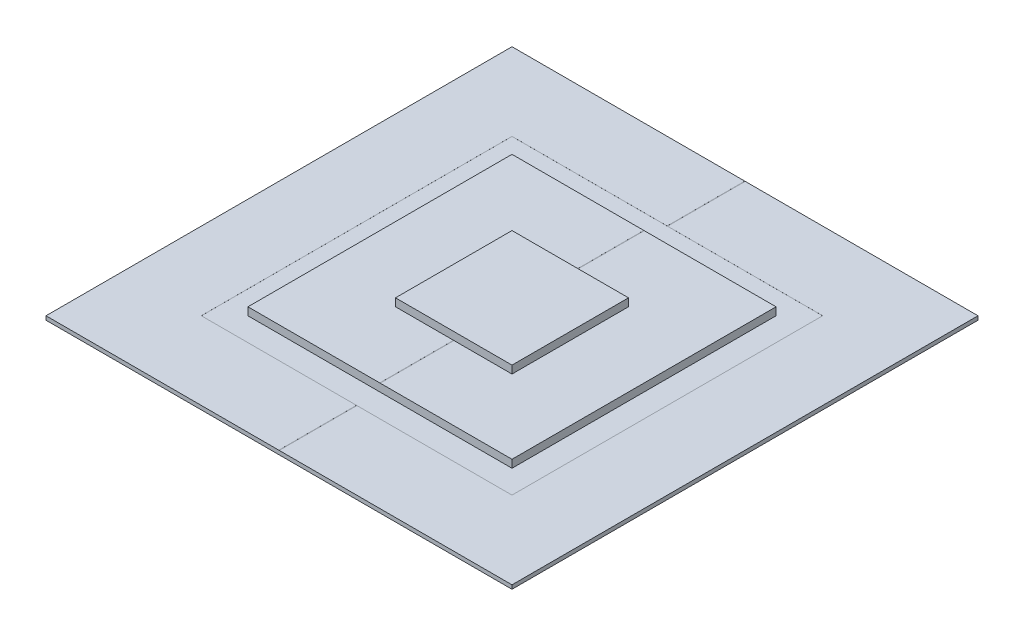
from build123d import *

# Parameters (mm, degrees)
SKETCH1_W             = 12000
SKETCH1_H             = 12000
SKETCH1_W_2           = 8000
SKETCH1_H_2           = 8000
BOSS_EXTRUDE1_DEPTH   = 100
SKETCH1_W_3           = 6800
SKETCH1_H_3           = 6800
BOSS_EXTRUDE1_2_DEPTH = 100
SKETCH2_W             = 8000
SKETCH2_H             = 8000
SKETCH2_W_2           = 6800
SKETCH2_H_2           = 6800
BOSS_EXTRUDE3_DEPTH   = 99
SKETCH3_W             = 10
SKETCH3_H             = 12000
CUT_EXTRUDE1_DEPTH    = 0.5
SKETCH4_W             = 3395
SKETCH4_H             = 6800
BOSS_EXTRUDE4_DEPTH   = 200
SKETCH5_W             = 10
SKETCH5_H             = 6800
BOSS_EXTRUDE5_DEPTH   = 200
SKETCH6_W             = 3000
SKETCH6_H             = 3000
BOSS_EXTRUDE6_DEPTH   = 200


with BuildPart() as part:
    # Sketch1 → Boss-Extrude1 (new body)
    with BuildSketch(Plane(origin=(0, 0, 0), x_dir=(1, 0, 0), z_dir=(0, 1, 0))):
        with Locations((6000, -6000)):
            Rectangle(SKETCH1_W, SKETCH1_H)
        with Locations((6000, -6000)):
            Rectangle(SKETCH1_W_2, SKETCH1_H_2, mode=Mode.SUBTRACT)
    extrude(amount=BOSS_EXTRUDE1_DEPTH)



with BuildPart() as body_2:
    # Sketch1 → Boss-Extrude1 2 (new body)
    with BuildSketch(Plane(origin=(0, 0, 0), x_dir=(1, 0, 0), z_dir=(0, 1, 0))):
        with Locations((6000, -6000)):
            Rectangle(SKETCH1_W_3, SKETCH1_H_3)
    extrude(amount=BOSS_EXTRUDE1_2_DEPTH)


with BuildPart() as part_1:
    add(part.part)

    add(body_2.part)  # Boss-Extrude3 merges body 2
    # Sketch2 → Boss-Extrude3 (add)
    with BuildSketch(Plane.XZ):
        with Locations((6000, 6000)):
            Rectangle(SKETCH2_W, SKETCH2_H)
        with Locations((6000, 6000)):
            Rectangle(SKETCH2_W_2, SKETCH2_H_2, mode=Mode.SUBTRACT)
    extrude(amount=-BOSS_EXTRUDE3_DEPTH)

    # Sketch3 → Cut-Extrude1 (cut)
    with BuildSketch(Plane(origin=(0, 100, 0), x_dir=(1, 0, 0), z_dir=(0, 1, 0))):
        with Locations((6000, -6000)):
            Rectangle(SKETCH3_W, SKETCH3_H)
    extrude(amount=-CUT_EXTRUDE1_DEPTH, mode=Mode.SUBTRACT)

    # Sketch4 → Boss-Extrude4 (add)
    with BuildSketch(Plane(origin=(0, 100, 0), x_dir=(1, 0, 0), z_dir=(0, 1, 0))):
        with Locations((4297.5, -6000)):
            Rectangle(SKETCH4_W, SKETCH4_H)
        with Locations((7702.5, -6000)):
            Rectangle(SKETCH4_W, SKETCH4_H)
    extrude(amount=BOSS_EXTRUDE4_DEPTH)

    # Sketch5 → Boss-Extrude5 (add)
    with BuildSketch(Plane(origin=(0, 99.5, 0), x_dir=(1, 0, 0), z_dir=(0, 1, 0))):
        with Locations((6000, -6000)):
            Rectangle(SKETCH5_W, SKETCH5_H)
    extrude(amount=BOSS_EXTRUDE5_DEPTH)

    # Sketch6 → Boss-Extrude6 (add)
    with BuildSketch(Plane(origin=(0, 300, 0), x_dir=(1, 0, 0), z_dir=(0, 1, 0))):
        with Locations((6000, -6000)):
            Rectangle(SKETCH6_W, SKETCH6_H)
    extrude(amount=BOSS_EXTRUDE6_DEPTH)


solid = part_1.part
